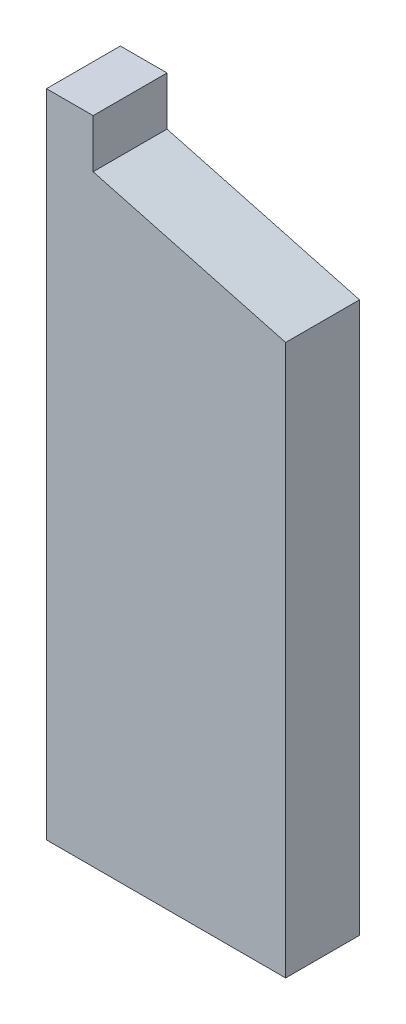
from build123d import *

# Parameters (mm, degrees)
EXTRUDE_1_DEPTH          = 7.6
CUT_EXTRUDE_1_DEPTH      = 72.697539881
CUT_EXTRUDE_1_DEPTH_BACK = 72.697539881


with BuildPart() as part:
    # 草图1 → 凸台-拉伸1 (new body)
    with BuildSketch(Plane.XY):
        Polygon((4.8, 0), (0, 0), (0, -66.915), (24.6, -66.915), (24.6, 0), (19.8, 0), (19.8, -5), (4.8, -5), align=None)
    extrude(amount=EXTRUDE_1_DEPTH)

    # 草图2 → 切除-拉伸1 (cut, two sides: drawn at the far end of the back side and taken through both)
    with BuildSketch(Plane.XY.offset(7.6).offset(-CUT_EXTRUDE_1_DEPTH_BACK)):
        Polygon((19.8, -5), (4.8, -5), (24.6, -10.30539401), (24.6, 0), (19.8, 0), align=None)
    extrude(amount=CUT_EXTRUDE_1_DEPTH + CUT_EXTRUDE_1_DEPTH_BACK, mode=Mode.SUBTRACT)


solid = part.part
